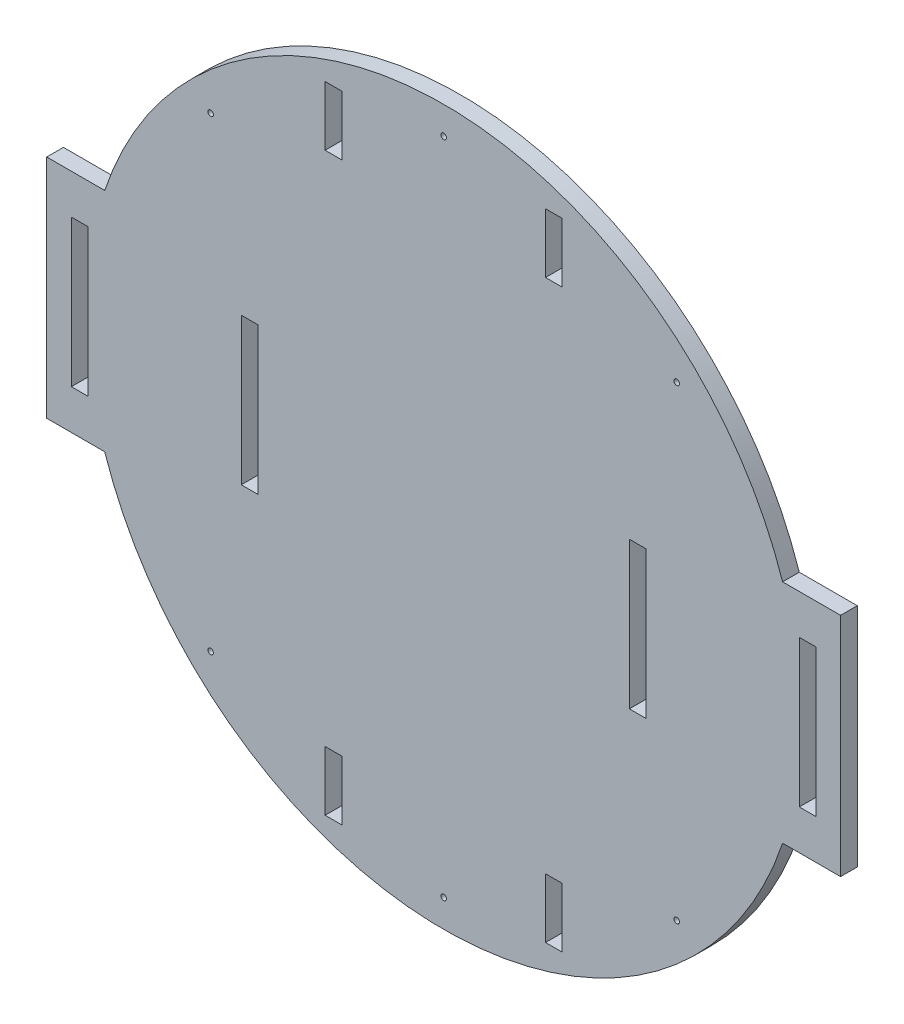
from build123d import *

# Parameters (mm, degrees)
SKETCH1_W                     = 5.334
SKETCH1_H                     = 46.99
BASE_PLATFORM_DEPTH           = 5.334
SKETCH5_R                     = 0.889
PERIMETER_STACKING_CUTS_DEPTH = 5.334
SKETCH6_W                     = 5.334
SKETCH6_H                     = 19.05
SKID_HOLES_DEPTH              = 5.334


with BuildPart() as part:
    # Sketch1 → Base Platform (new body)
    with BuildSketch(Plane.XY):
        with BuildLine():
            Line((126.959765957, -36.195), (108.417765957, -36.195))
            ThreePointArc((108.417765957, -36.195), (0, -114.3), (-108.417765957, -36.195))
            Line((-108.417765957, -36.195), (-126.959765957, -36.195))
            Line((-126.959765957, -36.195), (-126.959765957, 36.195))
            Line((-126.959765957, 36.195), (-108.417765957, 36.195))
            ThreePointArc((-108.417765957, 36.195), (0, 114.3), (108.417765957, 36.195))
            Line((108.417765957, 36.195), (126.959765957, 36.195))
            Line((126.959765957, 36.195), (126.959765957, -36.195))
        make_face()
        with Locations((-116.418765957, 0)):
            Rectangle(SKETCH1_W, SKETCH1_H, mode=Mode.SUBTRACT)
        with Locations((62.062765957, 0)):
            Rectangle(SKETCH1_W, SKETCH1_H, mode=Mode.SUBTRACT)
        with Locations((-62.062765957, 0)):
            Rectangle(SKETCH1_W, SKETCH1_H, mode=Mode.SUBTRACT)
        with Locations((116.418765957, 0)):
            Rectangle(SKETCH1_W, SKETCH1_H, mode=Mode.SUBTRACT)
    extrude(amount=BASE_PLATFORM_DEPTH)

    # Sketch5 → Perimeter stacking cuts (cut)
    with BuildSketch(Plane(origin=(0, 0, 0), x_dir=(-1, 0, 0), z_dir=(0, 0, -1))):
        with Locations((0, 105.41)):
            Circle(SKETCH5_R)
        with Locations((0, -105.41)):
            Circle(SKETCH5_R)
        with Locations((-74.536125805, 74.536125805)):
            Circle(SKETCH5_R)
        with Locations((74.536125805, 74.536125805)):
            Circle(SKETCH5_R)
        with Locations((74.536125805, -74.536125805)):
            Circle(SKETCH5_R)
        with Locations((-74.536125805, -74.536125805)):
            Circle(SKETCH5_R)
    extrude(amount=-PERIMETER_STACKING_CUTS_DEPTH, mode=Mode.SUBTRACT)

    # Sketch6 → Skid Holes (cut)
    with BuildSketch(Plane(origin=(0, 0, 0), x_dir=(-1, 0, 0), z_dir=(0, 0, -1))):
        with Locations((-35.251559841, 92.105443783)):
            Rectangle(SKETCH6_W, SKETCH6_H)
        with Locations((35.251559841, 92.105443783)):
            Rectangle(SKETCH6_W, SKETCH6_H)
        with Locations((35.251559841, -92.105443783)):
            Rectangle(SKETCH6_W, SKETCH6_H)
        with Locations((-35.251559841, -92.105443783)):
            Rectangle(SKETCH6_W, SKETCH6_H)
    extrude(amount=-SKID_HOLES_DEPTH, mode=Mode.SUBTRACT)


solid = part.part
